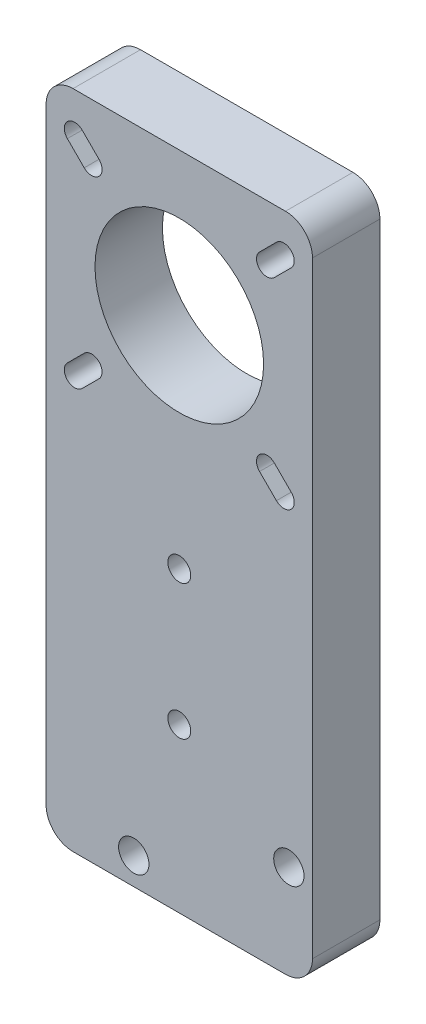
from build123d import *

# Parameters (mm, degrees)
SKETCH1_R                                          = 2.55
SKETCH1_R_2                                        = 12.5
BOSS_EXTRUDE1_DEPTH                                = 10
CHAMBRAGE_POUR_VIS_T_TE_RONDE_BOMB_E_M_D           = 3.4
CHAMBRAGE_POUR_VIS_T_TE_RONDE_BOMB_E_M_CBORE_D     = 7
CHAMBRAGE_POUR_VIS_T_TE_RONDE_BOMB_E_M_CBORE_DEPTH = 3.5
DIAM_TRE_DU_PER_AGE_4_5_4_5_1_D                    = 4.5


with BuildPart() as part:
    # Sketch1 → Boss-Extrude1 (new body)
    # profile 1 of 3: a face of its own
    with BuildSketch(Plane.XY):
        with BuildLine():
            Line((15.75, 49), (-15.75, 49))
            ThreePointArc((-15.75, 49), (-18.578427125, 47.828427125), (-19.75, 45))
            Line((-19.75, 45), (-19.75, -45))
            ThreePointArc((-19.75, -45), (-18.578427125, -47.828427125), (-15.75, -49))
            Line((-15.75, -49), (15.75, -49))
            ThreePointArc((15.75, -49), (18.578427125, -47.828427125), (19.75, -45))
            Line((19.75, -45), (19.75, 45))
            ThreePointArc((19.75, 45), (18.578427125, 47.828427125), (15.75, 49))
        make_face()
        with Locations((0, -4.8)):
            Circle(SKETCH1_R, mode=Mode.SUBTRACT)
        with Locations((0, -24.8)):
            Circle(SKETCH1_R, mode=Mode.SUBTRACT)
        with Locations((0, 27.75)):
            Circle(SKETCH1_R_2, mode=Mode.SUBTRACT)
        with BuildLine():
            ThreePointArc((-16.596015511, 13.346015511), (-16.596015511, 11.153984489), (-14.403984489, 11.153984489))
            Line((-14.403984489, 11.153984489), (-11.903984489, 13.653984489))
            ThreePointArc((-11.903984489, 13.653984489), (-11.903984489, 15.846015511), (-14.096015511, 15.846015511))
            Line((-14.096015511, 15.846015511), (-16.596015511, 13.346015511))
        make_face(mode=Mode.SUBTRACT)
        with BuildLine():
            ThreePointArc((16.596015511, 42.153984489), (16.596015511, 44.346015511), (14.403984489, 44.346015511))
            Line((14.403984489, 44.346015511), (11.903984489, 41.846015511))
            ThreePointArc((11.903984489, 41.846015511), (11.903984489, 39.653984489), (14.096015511, 39.653984489))
            Line((14.096015511, 39.653984489), (16.596015511, 42.153984489))
        make_face(mode=Mode.SUBTRACT)
        with BuildLine():
            Line((-14.096015511, 39.653984489), (-16.596015511, 42.153984489))
            ThreePointArc((-16.596015511, 42.153984489), (-16.596015511, 44.346015511), (-14.403984489, 44.346015511))
            Line((-14.403984489, 44.346015511), (-11.903984489, 41.846015511))
            ThreePointArc((-11.903984489, 41.846015511), (-11.903984489, 39.653984489), (-14.096015511, 39.653984489))
        make_face(mode=Mode.SUBTRACT)
        with BuildLine():
            Line((14.096015511, 15.846015511), (16.596015511, 13.346015511))
            ThreePointArc((16.596015511, 13.346015511), (16.596015511, 11.153984489), (14.403984489, 11.153984489))
            Line((14.403984489, 11.153984489), (11.903984489, 13.653984489))
            ThreePointArc((11.903984489, 13.653984489), (11.903984489, 15.846015511), (14.096015511, 15.846015511))
        make_face(mode=Mode.SUBTRACT)
    # profile 2 of 3: a face of its own
    with BuildSketch(Plane.XY):
        with Locations((0, -24.8)):
            Circle(SKETCH1_R)
    # profile 3 of 3: a face of its own
    with BuildSketch(Plane.XY):
        with Locations((0, -4.8)):
            Circle(SKETCH1_R)
    extrude(amount=BOSS_EXTRUDE1_DEPTH)

    # Chambrage pour vis à tête ronde bombée M31 (through all)
    with Locations(Plane(origin=(0, 0, 0), x_dir=(1, 0, 0), z_dir=(0, 0, -1))):
        with Locations((0, 4.8), (0, 24.8)):
            CounterBoreHole(CHAMBRAGE_POUR_VIS_T_TE_RONDE_BOMB_E_M_D / 2, CHAMBRAGE_POUR_VIS_T_TE_RONDE_BOMB_E_M_CBORE_D / 2, CHAMBRAGE_POUR_VIS_T_TE_RONDE_BOMB_E_M_CBORE_DEPTH)

    # Diamètre du perçage Ø4.5 (4.5)1 (through all)
    with Locations(Plane(origin=(0, 0, 0), x_dir=(-1, 0, 0), z_dir=(0, 0, -1))):
        with Locations((-16.25, -35), (6.75, -45)):
            Hole(DIAM_TRE_DU_PER_AGE_4_5_4_5_1_D / 2)


solid = part.part
